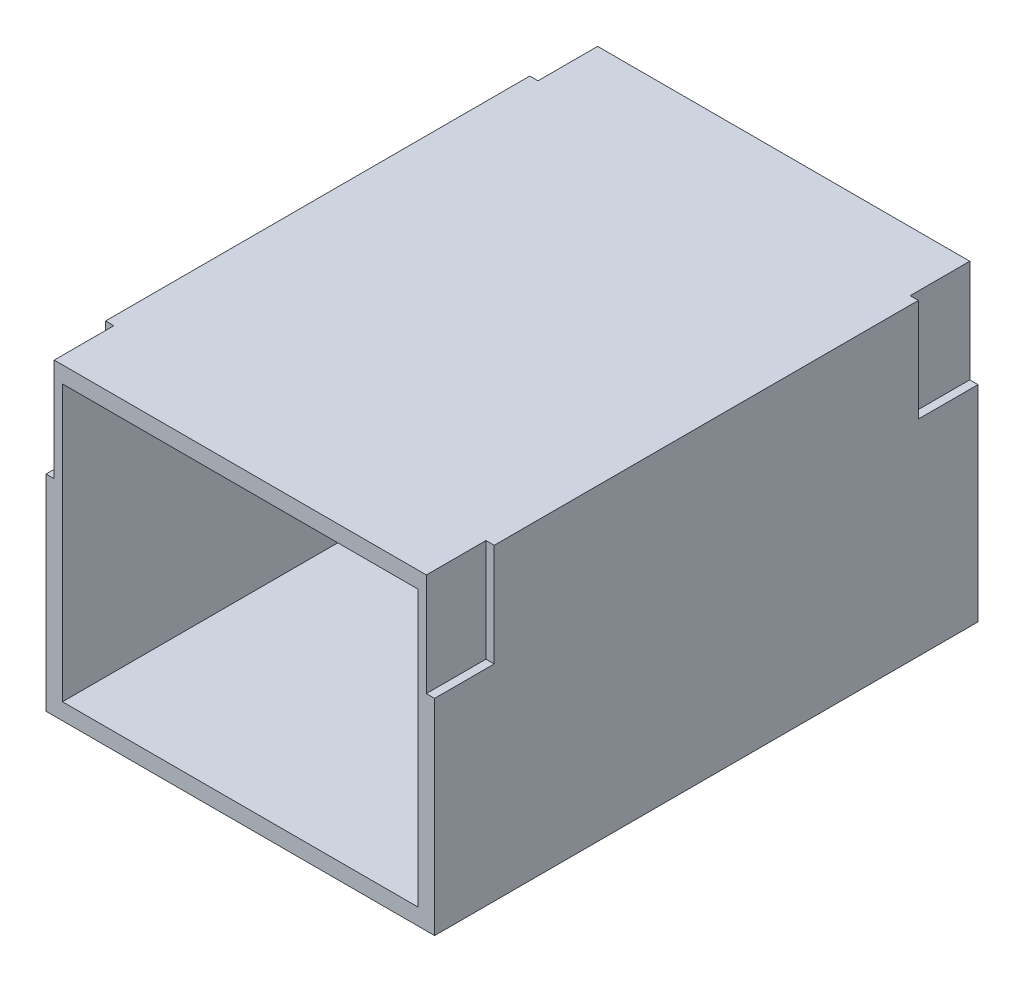
from build123d import *

# Parameters (mm, degrees)
SKETCH2_W      = 74.93
SKETCH2_H      = 59.436
SKETCH2_W_2    = 68.58
SKETCH2_H_2    = 53.086
EXTRUDE1_DEPTH = 104.775
SKETCH4_W      = 1.5875
SKETCH4_H      = 11.4935
EXTRUDE2_DEPTH = 19.812
SKETCH13_W     = 68.58
SKETCH13_H     = 53.086
EXTRUDE4_DEPTH = 1.5875


with BuildPart() as part:
    # Sketch2 → Extrude1 (new body)
    with BuildSketch(Plane.XY):
        with Locations((37.465, 29.718)):
            Rectangle(SKETCH2_W, SKETCH2_H)
        with Locations((37.465, 29.718)):
            Rectangle(SKETCH2_W_2, SKETCH2_H_2, mode=Mode.SUBTRACT)
    extrude(amount=-EXTRUDE1_DEPTH)

    # Sketch4 → Extrude2 (cut)
    with BuildSketch(Plane(origin=(0, 59.436, 0), x_dir=(-1, 0, 0), z_dir=(0, 1, 0))):
        with Locations((-0.79375, -99.02825)):
            Rectangle(SKETCH4_W, SKETCH4_H)
        with Locations((-0.79375, -5.74675)):
            Rectangle(SKETCH4_W, SKETCH4_H)
        with Locations((-74.13625, -5.74675)):
            Rectangle(SKETCH4_W, SKETCH4_H)
        with Locations((-74.13625, -99.02825)):
            Rectangle(SKETCH4_W, SKETCH4_H)
    extrude(amount=-EXTRUDE2_DEPTH, mode=Mode.SUBTRACT)

    # Sketch13 → Extrude4 (add)
    with BuildSketch(Plane(origin=(0, 0, -104.775), x_dir=(-1, 0, 0), z_dir=(0, 0, -1))):
        with Locations((-37.465, 29.718)):
            Rectangle(SKETCH13_W, SKETCH13_H)
    extrude(amount=-EXTRUDE4_DEPTH)


solid = part.part
